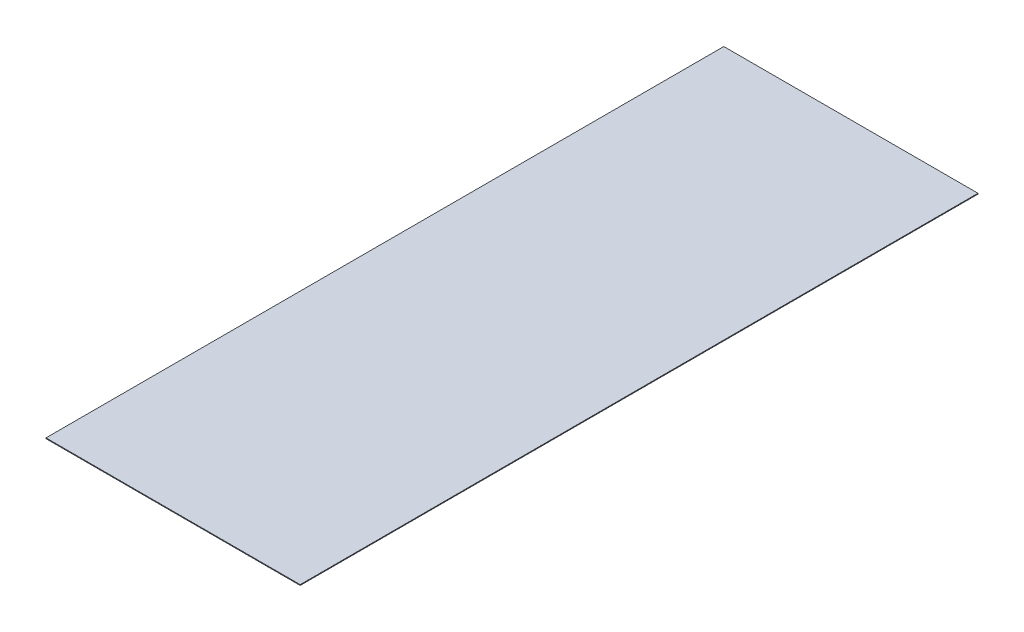
from build123d import *

# Parameters (mm, degrees)
CROQUIS1_W              = 914.4
CROQUIS1_H              = 2438.4
SALIENTE_EXTRUIR1_DEPTH = 2.7


with BuildPart() as part:
    # Croquis1 → Saliente-Extruir1 (new body)
    with BuildSketch(Plane(origin=(0, 0, 0), x_dir=(1, 0, 0), z_dir=(0, 1, 0))):
        Rectangle(CROQUIS1_W, CROQUIS1_H)
    extrude(amount=SALIENTE_EXTRUIR1_DEPTH)


solid = part.part
